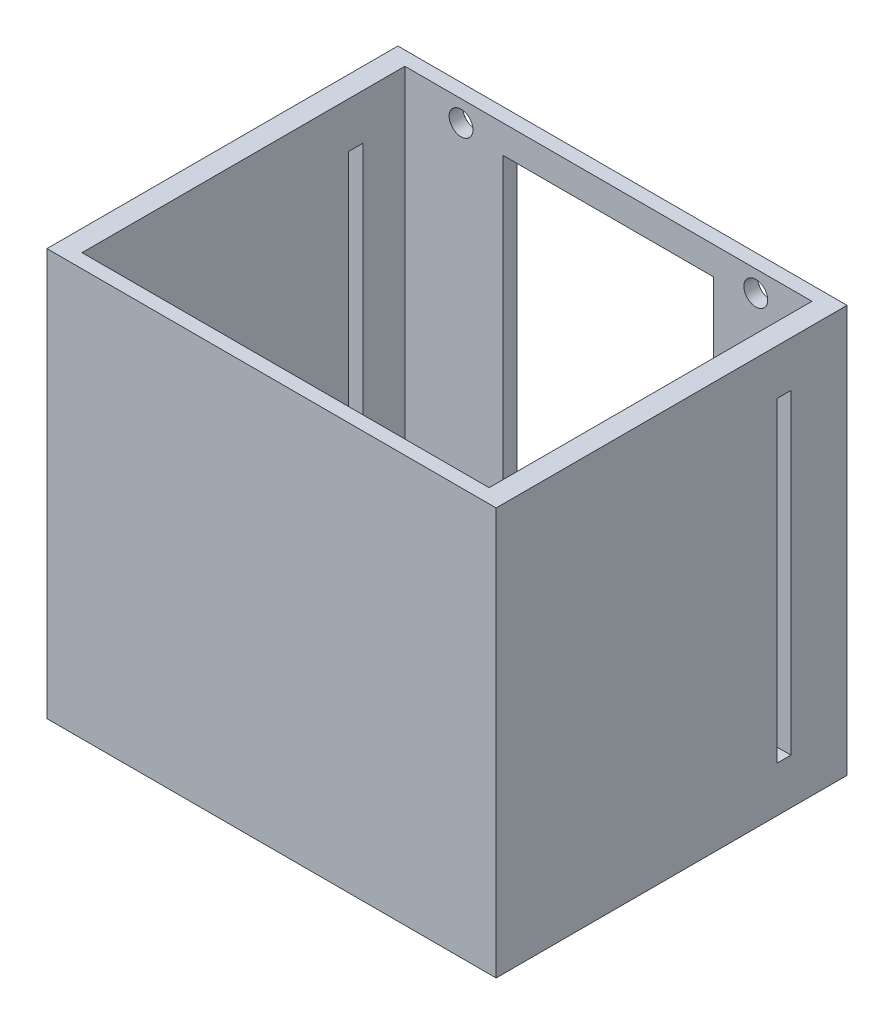
from build123d import *

# Parameters (mm, degrees)
SKETCH_1_W                   = 64
SKETCH_1_H                   = 50
EXTRUDE_2_DEPTH              = 58
SKETCH_2_W                   = 58
SKETCH_2_H                   = 46
CUT_EXTRUDE_1_DEPTH          = 71.802542327
SKETCH_5_W                   = 2
SKETCH_5_H                   = 45
CUT_EXTRUDE_2_DEPTH          = 50
SKETCH_6_W                   = 2
SKETCH_6_H                   = 45
CUT_EXTRUDE_3_DEPTH          = 50
HOLE_WIZARD_M3_1_D           = 3.4
HOLE_WIZARD_M3_1_DEPTH       = 5
HOLE_WIZARD_M3_1_CSINK_D     = 3.45
HOLE_WIZARD_M3_1_CSINK_ANGLE = 90
HOLE_WIZARD_M3_1_TIP         = 1.021463052
SKETCH_9_W                   = 30
SKETCH_9_H                   = 50
CUT_EXTRUDE_4_DEPTH          = 30


with BuildPart() as part:
    # 草图1 → 凸台-拉伸2 (new body)
    with BuildSketch(Plane(origin=(0, 0, 0), x_dir=(1, 0, 0), z_dir=(0, 1, 0))):
        Rectangle(SKETCH_1_W, SKETCH_1_H)
    extrude(amount=EXTRUDE_2_DEPTH)

    # 草图2 → 切除-拉伸1 (cut, through all)
    with BuildSketch(Plane.XZ):
        Rectangle(SKETCH_2_W, SKETCH_2_H)
    extrude(amount=-CUT_EXTRUDE_1_DEPTH, mode=Mode.SUBTRACT)

    # 草图5 → 切除-拉伸2 (cut)
    with BuildSketch(Plane.ZY.offset(-29)):
        with Locations((-16, 29)):
            Rectangle(SKETCH_5_W, SKETCH_5_H)
    extrude(amount=-CUT_EXTRUDE_2_DEPTH, mode=Mode.SUBTRACT)

    # 草图6 → 切除-拉伸3 (cut)
    with BuildSketch(Plane(origin=(-29, 0, 0), x_dir=(0, 0, -1), z_dir=(1, 0, 0))):
        with Locations((16, 29)):
            Rectangle(SKETCH_6_W, SKETCH_6_H)
    extrude(amount=-CUT_EXTRUDE_3_DEPTH, mode=Mode.SUBTRACT)

    # M3 间隙孔1
    with Locations(Plane(origin=(0, 0, -25), x_dir=(-1, 0, 0), z_dir=(0, 0, -1))):
        with Locations((-21, 55), (-21, 3), (21, 3), (21, 55)):
            CounterSinkHole(HOLE_WIZARD_M3_1_D / 2, HOLE_WIZARD_M3_1_CSINK_D / 2, depth=HOLE_WIZARD_M3_1_DEPTH, counter_sink_angle=HOLE_WIZARD_M3_1_CSINK_ANGLE)
            with Locations((0, 0, -(HOLE_WIZARD_M3_1_DEPTH + HOLE_WIZARD_M3_1_TIP / 2))):  # 118° drill point
                Cone(0, HOLE_WIZARD_M3_1_D / 2, HOLE_WIZARD_M3_1_TIP, mode=Mode.SUBTRACT)

    # 草图9 → 切除-拉伸4 (cut)
    with BuildSketch(Plane(origin=(0, 0, -25), x_dir=(-1, 0, 0), z_dir=(0, 0, -1))):
        with Locations((0, 29)):
            Rectangle(SKETCH_9_W, SKETCH_9_H)
    extrude(amount=-CUT_EXTRUDE_4_DEPTH, mode=Mode.SUBTRACT)


solid = part.part
